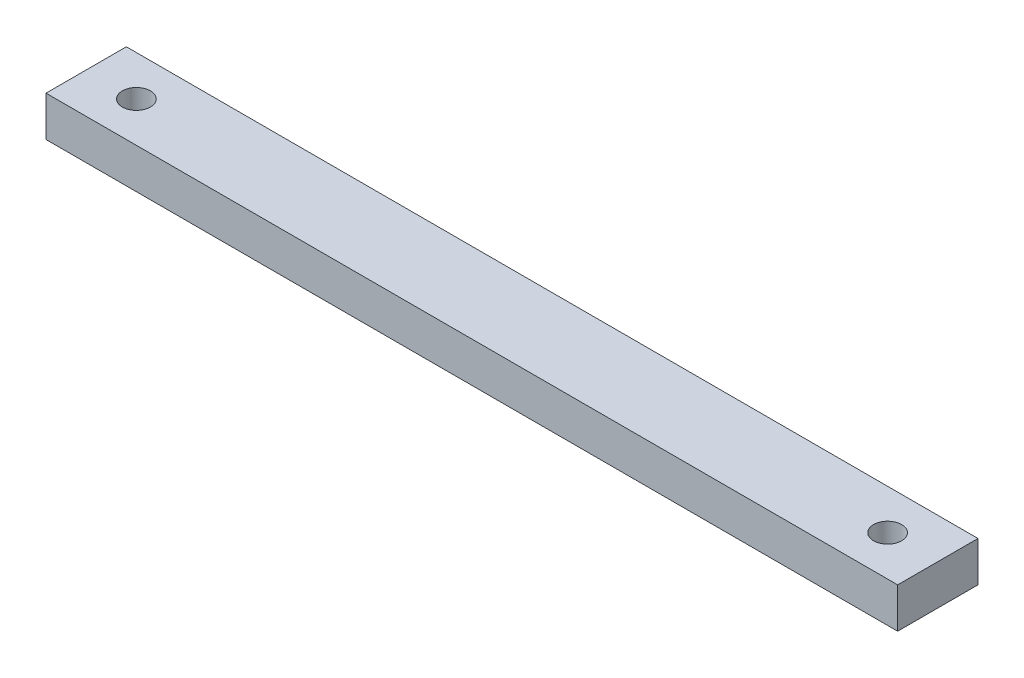
from build123d import *

# Parameters (mm, degrees)
SKETCH_1_W      = 21.2
SKETCH_1_H      = 2
SKETCH_1_R      = 0.35
EXTRUDE_1_DEPTH = 1


with BuildPart() as part:
    # Эскиз1 → Бобышка-Вытянуть1 (new body)
    with BuildSketch(Plane(origin=(0, 0, 0), x_dir=(1, 0, 0), z_dir=(0, 1, 0))):
        Rectangle(SKETCH_1_W, SKETCH_1_H)
        with Locations(Location((-9.35, 0, 0), (0, 0, 270))):
            Circle(SKETCH_1_R, mode=Mode.SUBTRACT)
        with Locations(Location((9.35, 0, 0), (0, 0, 90))):
            Circle(SKETCH_1_R, mode=Mode.SUBTRACT)
    extrude(amount=EXTRUDE_1_DEPTH)


solid = part.part
